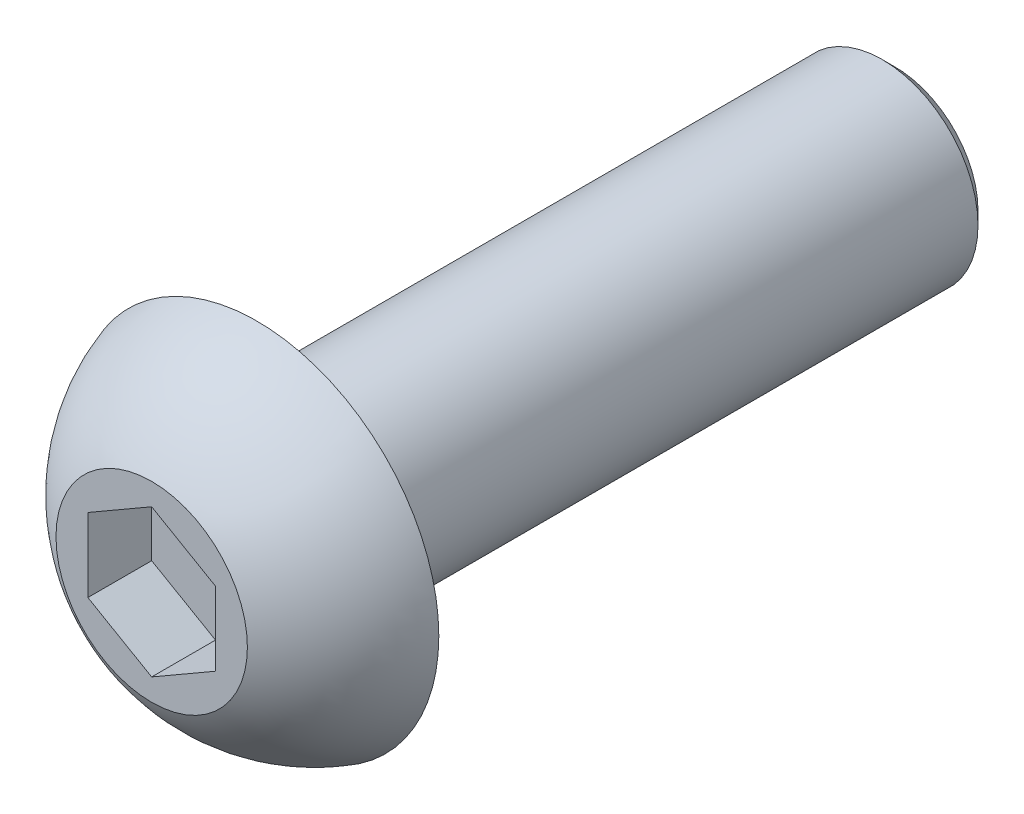
from build123d import *

# Parameters (mm, degrees)
CORTAR_EXTRUIR2_DEPTH = 1
CHAFL_N1_SIZE         = 0.2


with BuildPart() as part:
    # Croquis1 → Revolución1 (revolve)
    with BuildSketch(Plane(origin=(0, 0, 0), x_dir=(0, 0, -1), z_dir=(1, 0, 0)), mode=Mode.PRIVATE) as revoluci_n1_sk:
        with BuildLine():
            Line((0, 2.85), (0, 1.5))
            Line((0, 1.5), (10, 1.5))
            Line((10, 1.5), (10, 0))
            Line((10, 0), (-1.65, 0))
            Line((-1.65, 0), (-1.65, 1.5))
            ThreePointArc((-1.65, 1.5), (-0.955984269, 2.335091885), (0, 2.85))
        make_face()
    revolve(revoluci_n1_sk.sketch.rotate(Axis((0, 0, -10), (0, 0, -1)), 90), axis=Axis((0, 0, -10), (0, 0, -1)))

    # Croquis2 → Cortar-Extruir2 (cut)
    with BuildSketch(Plane.XY.offset(1.65)):
        Polygon((0, 1.154700538), (-1, 0.577350269), (-1, -0.577350269), (0, -1.154700538), (1, -0.577350269), (1, 0.577350269), align=None)
    extrude(amount=-CORTAR_EXTRUIR2_DEPTH, mode=Mode.SUBTRACT)

    # Chaflán1
    chafl_n1_edges = [part.edges().sort_by_distance(p)[0] for p in [
        (-1.5, 0, -10),
    ]]
    chamfer(chafl_n1_edges, length=CHAFL_N1_SIZE)


solid = part.part
